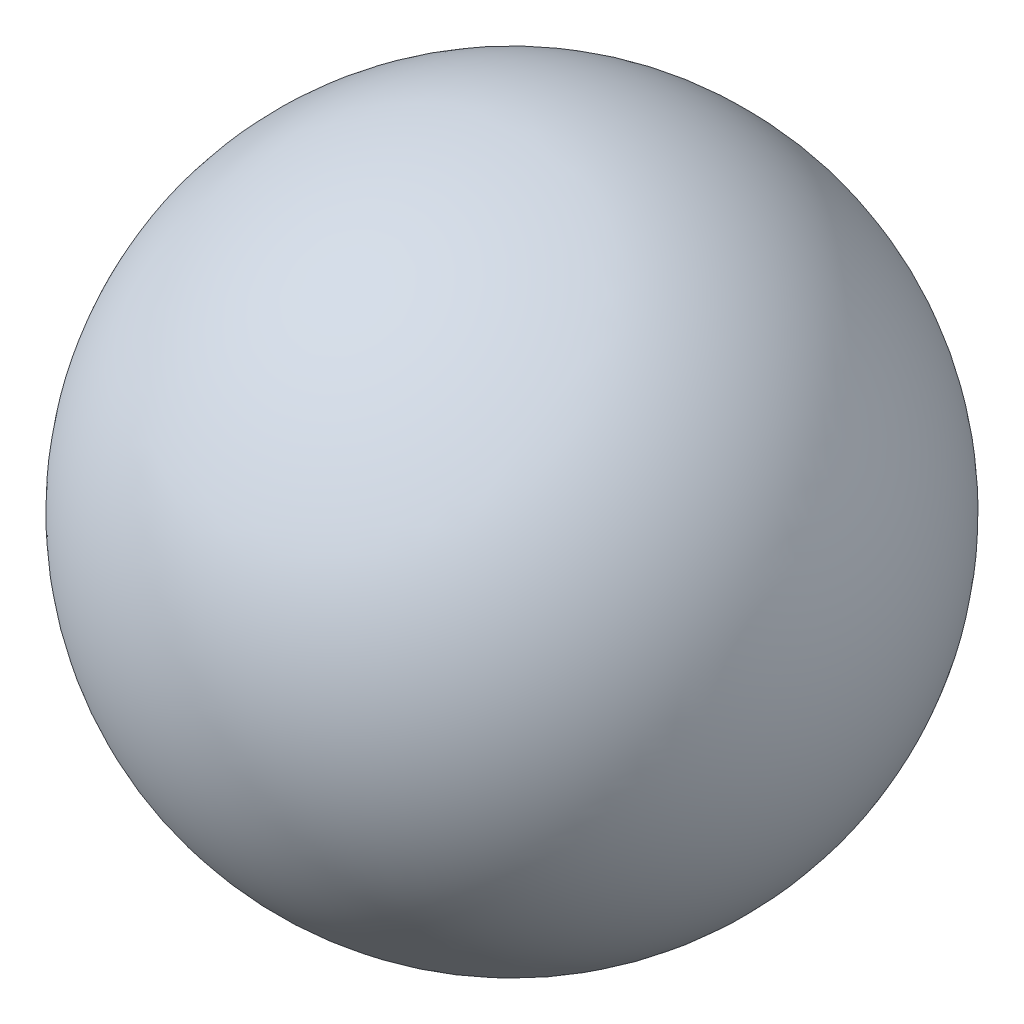
from build123d import *


with BuildPart() as part:
    # Sketch1 → Revolve1 (revolve)
    with BuildSketch(Plane.XY):
        with BuildLine():
            Line((-10.36482025, 0), (11.63517975, 0))
            ThreePointArc((11.63517975, 0), (0.63517975, -11), (-10.36482025, 0))
        make_face()
    revolve(axis=Axis((-10.36482025, 0, 0), (1, 0, 0)))


solid = part.part
